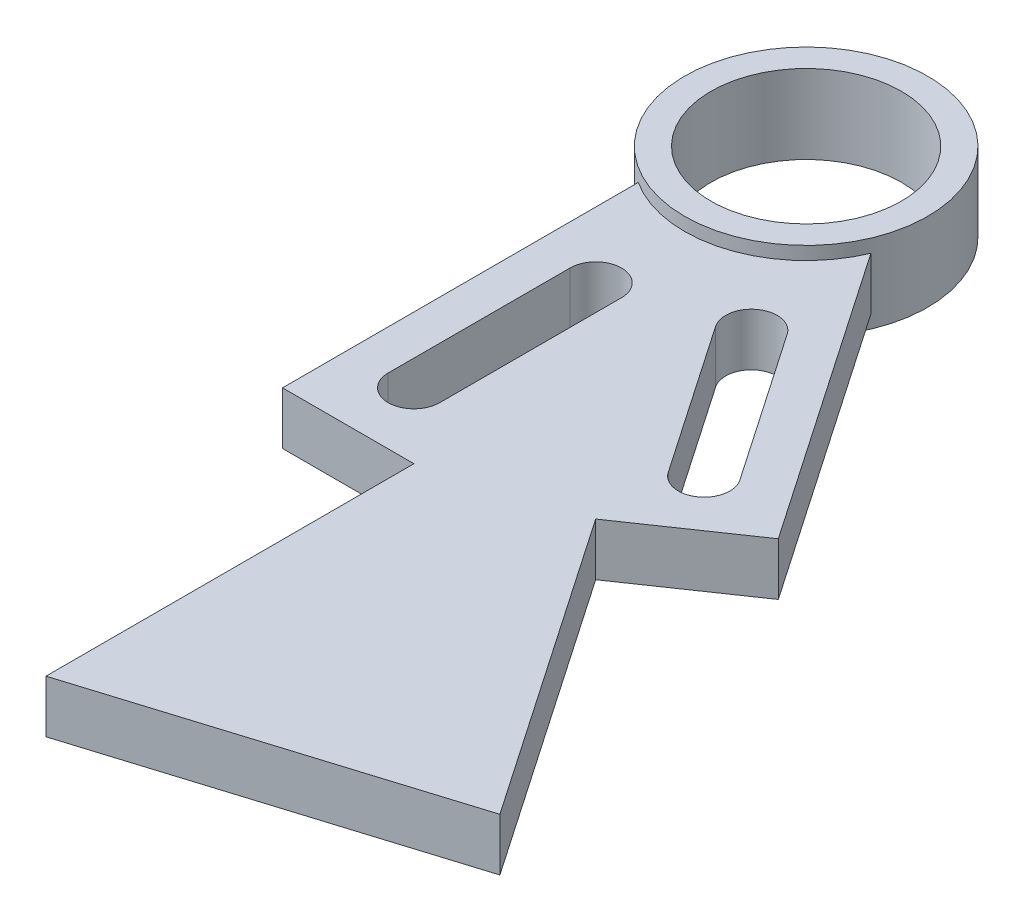
from build123d import *

# Parameters (mm, degrees)
SKETCH1_R             = 11.5062
BEARING_EXTRUDE_DEPTH = 4.7625
BOSS_EXTRUDE2_DEPTH   = 3.175


with BuildPart() as part:
    # Sketch1 → Bearing extrude (new, symmetric)
    with BuildSketch(Plane(origin=(0, 0, 0), x_dir=(1, 0, 0), z_dir=(0, 1, 0))):
        with BuildLine():
            ThreePointArc((14.6812, 0), (-7.035822924, 12.885450292), (-7.9375, -12.350454534))
            ThreePointArc((-7.9375, -12.350454534), (4.340724892, -14.024825876), (13.526429759, -5.707305091))
            ThreePointArc((13.526429759, -5.707305091), (14.389611774, -2.911478392), (14.6812, 0))
        make_face()
        Circle(SKETCH1_R, mode=Mode.SUBTRACT)
    extrude(amount=BEARING_EXTRUDE_DEPTH, both=True)

    # Sketch1<5> → Boss-Extrude2 (add, symmetric)
    with BuildSketch(Plane(origin=(0, 0, 0), x_dir=(1, 0, 0), z_dir=(0, 1, 0))):
        with BuildLine():
            Line((-7.9375, -12.350454534), (-7.9375, -55.3212))
            Line((-7.9375, -55.3212), (7.9375, -55.3212))
            Line((7.9375, -55.3212), (7.9375, -99.7712))
            Line((7.9375, -99.7712), (49.810371091, -86.811423139))
            Line((49.810371091, -86.811423139), (24.700852243, -50.132893136))
            Line((24.700852243, -50.132893136), (31.250589743, -45.649050484))
            Line((31.250589743, -45.649050484), (37.800327244, -41.165207833))
            Line((37.800327244, -41.165207833), (13.526429759, -5.707305091))
            ThreePointArc((13.526429759, -5.707305091), (4.340724892, -14.024825876), (-7.9375, -12.350454534))
        make_face()
        with BuildLine():
            ThreePointArc((3.1115, -47.3837), (0, -50.4952), (-3.1115, -47.3837))
            Line((-3.1115, -47.3837), (-3.1115, -25.4127))
            ThreePointArc((-3.1115, -25.4127), (0, -22.3012), (3.1115, -25.4127))
            Line((3.1115, -25.4127), (3.1115, -47.3837))
        make_face(mode=Mode.SUBTRACT)
        with BuildLine():
            ThreePointArc((29.334244192, -37.341646664), (29.825099476, -39.671949821), (28.524413411, -41.666810084))
            ThreePointArc((28.524413411, -41.666810084), (26.194110255, -42.157665367), (24.199249992, -40.856979303))
            Line((24.199249992, -40.856979303), (11.787973533, -22.727305901))
            ThreePointArc((11.787973533, -22.727305901), (12.597804313, -18.402142482), (16.922967733, -19.211973263))
            Line((16.922967733, -19.211973263), (29.334244192, -37.341646664))
        make_face(mode=Mode.SUBTRACT)
    extrude(amount=BOSS_EXTRUDE2_DEPTH, both=True)


solid = part.part
